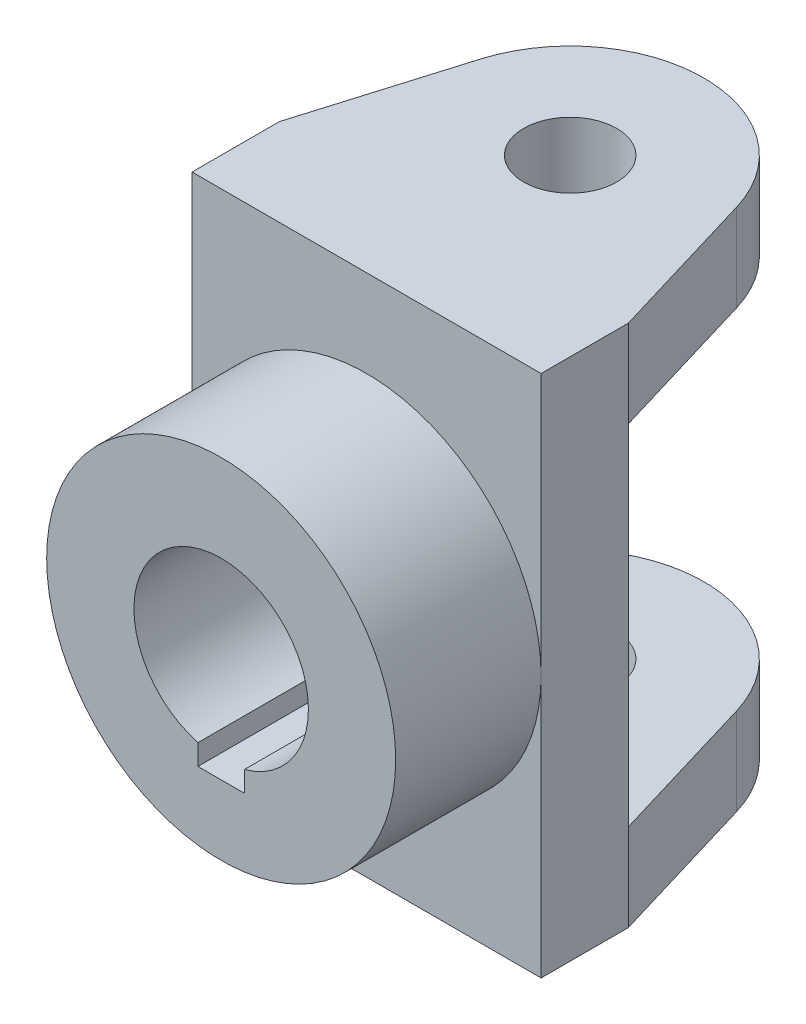
from build123d import *

# Parameters (mm, degrees)
SKETCH1_W           = 60
SKETCH1_H           = 90
BOSS_EXTRUDE1_DEPTH = 15
SKETCH2_R           = 30
BOSS_EXTRUDE2_DEPTH = 25
SKETCH3_R           = 8
BOSS_EXTRUDE3_DEPTH = 15


with BuildPart() as part:
    # Sketch1 → Boss-Extrude1 (new body)
    with BuildSketch(Plane.XY):
        Rectangle(SKETCH1_W, SKETCH1_H)
    extrude(amount=BOSS_EXTRUDE1_DEPTH)

    # Sketch2 → Boss-Extrude2 (add)
    with BuildSketch(Plane.XY.offset(15)):
        Circle(SKETCH2_R)
        with BuildLine():
            Line((-4, -14.456832295), (-4, -18))
            Line((-4, -18), (4, -18))
            Line((4, -18), (4, -14.456832295))
            ThreePointArc((4, -14.456832295), (0, 15), (-4, -14.456832295))
        make_face(mode=Mode.SUBTRACT)
    extrude(amount=BOSS_EXTRUDE2_DEPTH)

    # Sketch3 → Boss-Extrude3 (add)
    with BuildSketch(Plane(origin=(0, 45, 0), x_dir=(1, 0, 0), z_dir=(0, 1, 0))):
        with BuildLine():
            Line((30, 0), (22.03289839, 26.599347585))
            ThreePointArc((22.03289839, 26.599347585), (0, 43), (-22.03289839, 26.599347585))
            Line((-22.03289839, 26.599347585), (-30, 0))
            Line((-30, 0), (30, 0))
        make_face()
        with Locations(Location((0, 20, 0), (0, 0, 180))):
            Circle(SKETCH3_R, mode=Mode.SUBTRACT)
    boss_extrude3 = extrude(amount=-BOSS_EXTRUDE3_DEPTH)

    # Mirror1: Boss-Extrude3 across plane
    add(boss_extrude3.mirror(Plane.ZX))


solid = part.part
